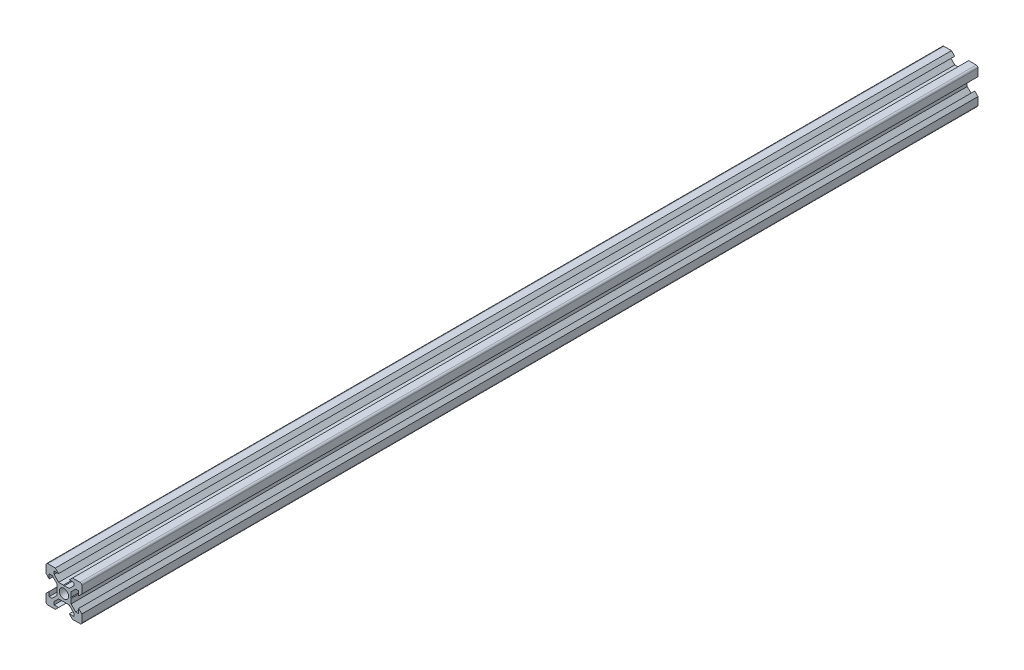
from build123d import *

# Parameters (mm, degrees)
SKETCH1_R           = 2.6
BOSS_EXTRUDE1_DEPTH = 500


with BuildPart() as part:
    # Sketch1 → Boss-Extrude1 (new body)
    with BuildSketch(Plane.XY):
        with BuildLine():
            Line((10.336788111, -8.113366567), (10.336788111, -3.913366567))
            Line((10.336788111, -3.913366567), (8.536788111, -2.113366567))
            Line((8.536788111, -2.113366567), (8.536788111, -4.613366567))
            Line((8.536788111, -4.613366567), (6.897448282, -4.613366567))
            Line((6.897448282, -4.613366567), (4.336788111, -2.052706395))
            Line((4.336788111, -2.052706395), (4.336788111, 0.586633433))
            Line((4.336788111, 0.586633433), (4.036788111, 0.886633433))
            Line((4.036788111, 0.886633433), (4.336788111, 1.186633433))
            Line((4.336788111, 1.186633433), (4.336788111, 3.825973261))
            Line((4.336788111, 3.825973261), (6.897448282, 6.386633433))
            Line((6.897448282, 6.386633433), (8.536788111, 6.386633433))
            Line((8.536788111, 6.386633433), (8.536788111, 3.886633433))
            Line((8.536788111, 3.886633433), (10.336788111, 5.686633433))
            Line((10.336788111, 5.686633433), (10.336788111, 9.886633433))
            ThreePointArc((10.336788111, 9.886633433), (10.043894892, 10.593740214), (9.336788111, 10.886633433))
            Line((9.336788111, 10.886633433), (5.136788111, 10.886633433))
            Line((5.136788111, 10.886633433), (3.336788111, 9.086633433))
            Line((3.336788111, 9.086633433), (5.836788111, 9.086633433))
            Line((5.836788111, 9.086633433), (5.836788111, 7.447293605))
            Line((5.836788111, 7.447293605), (3.276127939, 4.886633433))
            Line((3.276127939, 4.886633433), (0.636788111, 4.886633433))
            Line((0.636788111, 4.886633433), (0.336788111, 4.586633433))
            Line((0.336788111, 4.586633433), (0.036788111, 4.886633433))
            Line((0.036788111, 4.886633433), (-2.602551718, 4.886633433))
            Line((-2.602551718, 4.886633433), (-5.163211889, 7.447293605))
            Line((-5.163211889, 7.447293605), (-5.163211889, 9.086633433))
            Line((-5.163211889, 9.086633433), (-2.663211889, 9.086633433))
            Line((-2.663211889, 9.086633433), (-4.463211889, 10.886633433))
            Line((-4.463211889, 10.886633433), (-8.663211889, 10.886633433))
            ThreePointArc((-8.663211889, 10.886633433), (-9.370318671, 10.593740214), (-9.663211889, 9.886633433))
            Line((-9.663211889, 9.886633433), (-9.663211889, 5.686633433))
            Line((-9.663211889, 5.686633433), (-7.863211889, 3.886633433))
            Line((-7.863211889, 3.886633433), (-7.863211889, 6.386633433))
            Line((-7.863211889, 6.386633433), (-6.223872061, 6.386633433))
            Line((-6.223872061, 6.386633433), (-3.663211889, 3.825973261))
            Line((-3.663211889, 3.825973261), (-3.663211889, 1.186633433))
            Line((-3.663211889, 1.186633433), (-3.363211889, 0.886633433))
            Line((-3.363211889, 0.886633433), (-3.663211889, 0.586633433))
            Line((-3.663211889, 0.586633433), (-3.663211889, -2.052706395))
            Line((-3.663211889, -2.052706395), (-6.223872061, -4.613366567))
            Line((-6.223872061, -4.613366567), (-7.863211889, -4.613366567))
            Line((-7.863211889, -4.613366567), (-7.863211889, -2.113366567))
            Line((-7.863211889, -2.113366567), (-9.663211889, -3.913366567))
            Line((-9.663211889, -3.913366567), (-9.663211889, -8.113366567))
            ThreePointArc((-9.663211889, -8.113366567), (-9.370318671, -8.820473348), (-8.663211889, -9.113366567))
            Line((-8.663211889, -9.113366567), (-4.463211889, -9.113366567))
            Line((-4.463211889, -9.113366567), (-2.663211889, -7.313366567))
            Line((-2.663211889, -7.313366567), (-5.163211889, -7.313366567))
            Line((-5.163211889, -7.313366567), (-5.163211889, -5.674026739))
            Line((-5.163211889, -5.674026739), (-2.602551718, -3.113366567))
            Line((-2.602551718, -3.113366567), (0.036788111, -3.113366567))
            Line((0.036788111, -3.113366567), (0.336788111, -2.813366567))
            Line((0.336788111, -2.813366567), (0.636788111, -3.113366567))
            Line((0.636788111, -3.113366567), (3.276127939, -3.113366567))
            Line((3.276127939, -3.113366567), (5.836788111, -5.674026739))
            Line((5.836788111, -5.674026739), (5.836788111, -7.313366567))
            Line((5.836788111, -7.313366567), (3.336788111, -7.313366567))
            Line((3.336788111, -7.313366567), (5.136788111, -9.113366567))
            Line((5.136788111, -9.113366567), (9.336788111, -9.113366567))
            ThreePointArc((9.336788111, -9.113366567), (10.043894892, -8.820473348), (10.336788111, -8.113366567))
        make_face()
        with Locations((0.336788111, 0.886633433)):
            Circle(SKETCH1_R, mode=Mode.SUBTRACT)
    extrude(amount=BOSS_EXTRUDE1_DEPTH)


solid = part.part
